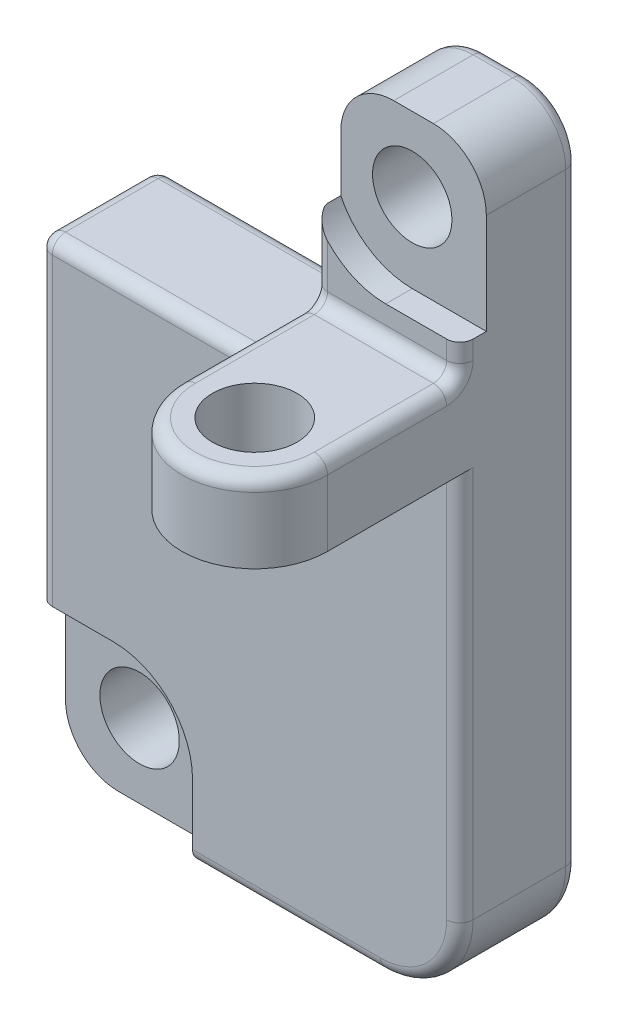
from build123d import *
from OCP.BRepFilletAPI import BRepFilletAPI_MakeFillet

# Parameters (mm, degrees)
SKETCH1_R           = 1.5
BOSS_EXTRUDE1_DEPTH = 4.5
SKETCH3_R           = 1.6
BOSS_EXTRUDE2_DEPTH = 3
FILLET1_R1          = 2
FILLET1_R2          = 3
FILLET2_R           = 0.5
CUT_EXTRUDE1_DEPTH  = 1


with BuildPart() as part:
    # Sketch1 → Boss-Extrude1 (new body)
    with BuildSketch(Plane.XY):
        Polygon((-10.4, 0), (0, 0), (0, 10), (5.5, 10), (5.5, -17.8), (-10.4, -17.8), align=None)
        with Locations((2.7, 7.2)):
            Circle(SKETCH1_R, mode=Mode.SUBTRACT)
        with Locations((-7.6, -15)):
            Circle(SKETCH1_R, mode=Mode.SUBTRACT)
    extrude(amount=BOSS_EXTRUDE1_DEPTH)

    # Sketch3 → Boss-Extrude2 (add)
    with BuildSketch(Plane(origin=(0, 0, 0), x_dir=(1, 0, 0), z_dir=(0, 1, 0))):
        with BuildLine():
            Line((5.5, -4.5), (0, -4.5))
            Line((0, -4.5), (0, -9.5))
            ThreePointArc((0, -9.5), (2.75, -12.25), (5.5, -9.5))
            Line((5.5, -9.5), (5.5, -4.5))
        make_face()
        with Locations((2.75, -9.5)):
            Circle(SKETCH3_R, mode=Mode.SUBTRACT)
    extrude(amount=BOSS_EXTRUDE2_DEPTH)

    # Fillet1: one fillet with a radius per group of edges: ONE call of the kernel's fillet builder (fillet() takes one radius for all edges)
    fillet1_edges_1 = [part.edges().sort_by_distance(p)[0] for p in [
        (-10.4, -17.8, 2.25),
        (5.5, 10, 2.25),
        (0, 10, 2.25),
    ]]
    fillet1_edges_2 = [part.edges().sort_by_distance(p)[0] for p in [
        (5.5, -17.8, 2.25),
    ]]
    fillet1 = BRepFilletAPI_MakeFillet(part.part.solid().wrapped)
    for e in fillet1_edges_1:
        fillet1.Add(FILLET1_R1, e.wrapped)
    for e in fillet1_edges_2:
        fillet1.Add(FILLET1_R2, e.wrapped)
    add(Compound.cast(fillet1.Shape()), mode=Mode.REPLACE)

    # Fillet2
    fillet2_edges = [part.edges().sort_by_distance(p)[0] for p in [
        (2.75, 3, 12.25),
        (5.5, 3, 7),
        (0, 3, 7),
        (0.585786438, 9.414213562, 0),
        (4.914213562, 9.414213562, 0),
        (2.75, 10, 0),
        (4.914213562, 9.414213562, 4.5),
        (0.585786438, 9.414213562, 4.5),
        (2.75, 10, 4.5),
        (0, 5.5, 4.5),
        (5.5, 5.5, 4.5),
        (2.75, 3, 4.5),
        (4.621320344, -16.921320344, 0),
        (5.5, -3.4, 0),
        (-9.814213562, -17.214213562, 0),
        (-2.95, -17.8, 0),
        (0, 4, 0),
        (-5.2, 0, 0),
        (-10.4, -7.9, 0),
        (-10.4, 0, 2.25),
        (-5.2, 0, 4.5),
        (4.621320344, -16.921320344, 4.5),
        (-9.814213562, -17.214213562, 4.5),
        (5.5, -7.4, 4.5),
        (-2.95, -17.8, 4.5),
        (-10.4, -7.9, 4.5),
    ]]
    fillet(fillet2_edges, radius=FILLET2_R)

    # Sketch6 → Cut-Extrude1 (cut)
    with BuildSketch(Plane.XY.offset(4.5)):
        with BuildLine():
            Line((-0.3, 7.2), (-0.3, 10))
            Line((-0.3, 10), (5.5, 10))
            Line((5.5, 10), (5.5, 4.2))
            Line((5.5, 4.2), (2.7, 4.2))
            ThreePointArc((2.7, 4.2), (0.578679656, 5.078679656), (-0.3, 7.2))
        make_face()
        with BuildLine():
            Line((-7.6, -12), (-10.4, -12))
            Line((-10.4, -12), (-10.4, -17.8))
            Line((-10.4, -17.8), (-4.6, -17.8))
            Line((-4.6, -17.8), (-4.6, -15))
            ThreePointArc((-4.6, -15), (-5.478679656, -12.878679656), (-7.6, -12))
        make_face()
    extrude(amount=-CUT_EXTRUDE1_DEPTH, mode=Mode.SUBTRACT)


solid = part.part
